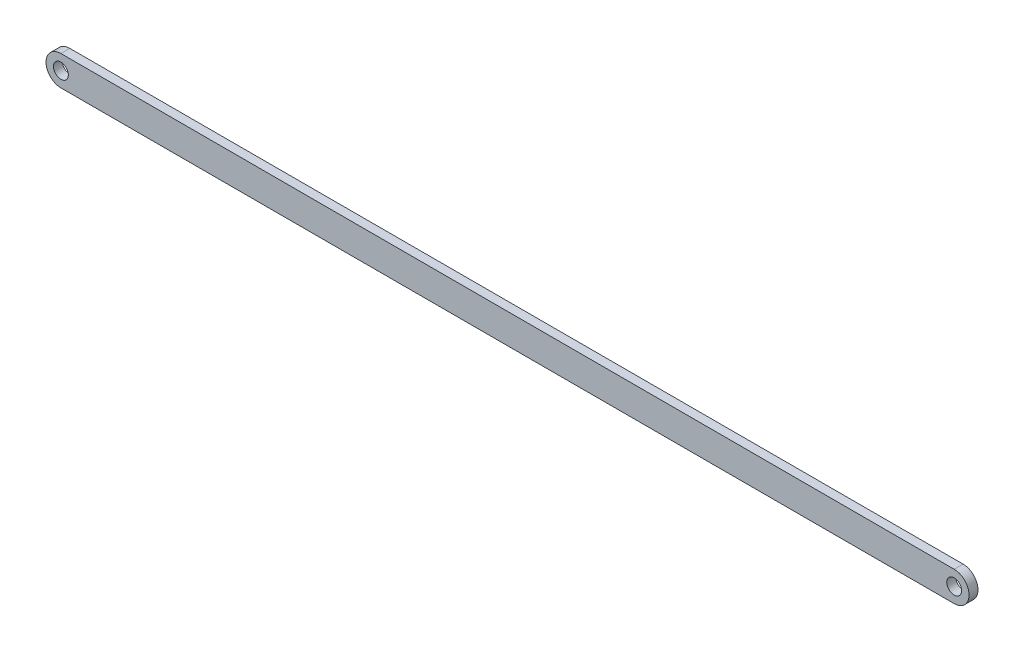
from build123d import *

# Parameters (mm, degrees)
BOSS_EXTRUDE1_DEPTH = 3
CUT_EXTRUDE1_REACH  = 157.11
SKETCH2_R           = 2.5


with BuildPart() as part:
    # Sketch1 → Boss-Extrude1 (new body)
    with BuildSketch(Plane.XY):
        with BuildLine():
            Line((-150, 5), (150, 5))
            ThreePointArc((150, 5), (155, 0), (150, -5))
            Line((150, -5), (-150, -5))
            ThreePointArc((-150, -5), (-155, 0), (-150, 5))
        make_face()
    extrude(amount=BOSS_EXTRUDE1_DEPTH)

    # Sketch2 → Cut-Extrude1 (cut, up to next)
    with BuildSketch(Plane.XY.offset(3), mode=Mode.PRIVATE) as cut_extrude1_sk1:
        with Locations((-150, 0)):
            Circle(SKETCH2_R)
    cut_extrude1_tool1 = extrude(cut_extrude1_sk1.sketch, amount=-CUT_EXTRUDE1_REACH, mode=Mode.PRIVATE) & part.part
    cut_extrude1 = cut_extrude1_tool1.solids().sort_by_distance((-150, 0, 3))[0]
    add(cut_extrude1, mode=Mode.SUBTRACT)

    # Mirror1: Cut-Extrude1 across plane
    add(cut_extrude1.mirror(Plane(origin=(0, 0, 0), x_dir=(0, 0, 1), z_dir=(1, 0, 0))), mode=Mode.SUBTRACT)


solid = part.part
